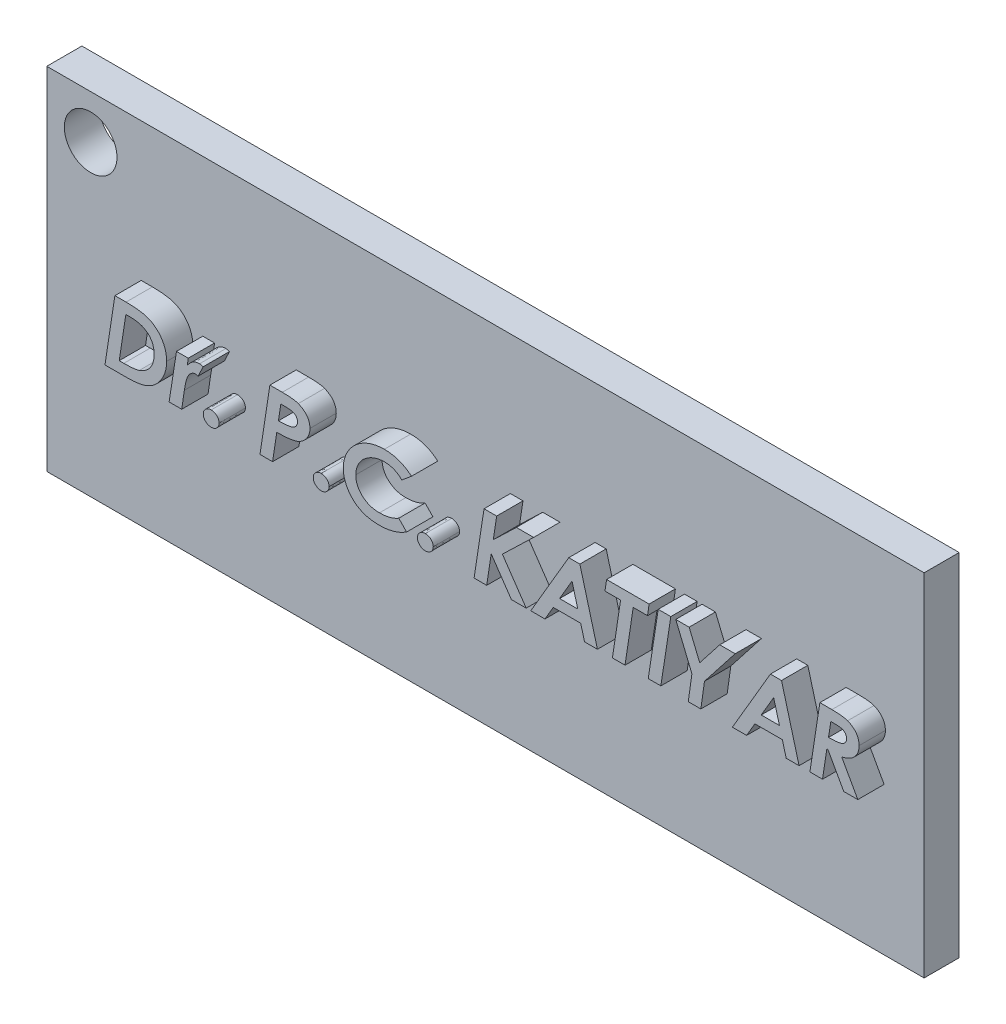
from build123d import *

# Parameters (mm, degrees)
SKETCH1_W           = 50
SKETCH1_H           = 20
BOSS_EXTRUDE1_DEPTH = 2
SKETCH2_R           = 1.5
CUT_EXTRUDE1_DEPTH  = 2
BOSS_EXTRUDE2_DEPTH = 1.5


with BuildPart() as part:
    # Sketch1 → Boss-Extrude1 (new body)
    with BuildSketch(Plane.XY):
        Rectangle(SKETCH1_W, SKETCH1_H)
    extrude(amount=BOSS_EXTRUDE1_DEPTH)

    # Sketch2 → Cut-Extrude1 (cut)
    with BuildSketch(Plane.XY.offset(2)):
        with Locations((-22.5, 7.5)):
            Circle(SKETCH2_R)
    extrude(amount=-CUT_EXTRUDE1_DEPTH, mode=Mode.SUBTRACT)

    # Sketch3 → Boss-Extrude2 (add)
    # profile 1 of 14: a face of its own
    with BuildSketch(Plane.XY.offset(2)):
        with BuildLine():
            Line((-19.618322876, 2.120230113), (-18.982411251, 2.120230113))
            add(Edge.make_bspline(
                [(-18.982411251, 2.120230113), (-18.910426999, 2.119678229), (-18.771099411, 2.118610042), (-18.569112915, 2.109927794), (-18.381253338, 2.09439893), (-18.207658036, 2.073252772), (-18.048344555, 2.046057077), (-17.903370359, 2.012808646), (-17.772236677, 1.974379293), (-17.654652897, 1.927094543), (-17.546335915, 1.87486867), (-17.444825411, 1.81494882), (-17.348670953, 1.748094557), (-17.256707082, 1.675274738), (-17.170399162, 1.594845432), (-17.089661137, 1.506798235), (-17.01296808, 1.412819612), (-16.94283675, 1.311942205), (-16.878923226, 1.20609193), (-16.822939281, 1.09537145), (-16.776662067, 0.980194019), (-16.737396953, 0.861662087), (-16.708059399, 0.738710988), (-16.686424434, 0.611834465), (-16.673714674, 0.480871104), (-16.67192349, 0.392338604), (-16.671017187, 0.34754298)],
                knots=[0, 0, 0, 0, 1.561455984, 3.022242913, 4.384337269, 5.649427236, 6.814641123, 7.888375834, 8.874559248, 9.775230347, 10.634285137, 11.480850549, 12.329182329, 13.172971857, 14.023337196, 14.885218906, 15.762543274, 16.652620804, 17.547922369, 18.442918428, 19.3406122, 20.238161656, 21.149081977, 22.07965206, 23.028343428, 24, 24, 24, 24], degree=3))
            add(Edge.make_bspline(
                [(-16.671017187, 0.34754298), (-16.671780039, 0.301249759), (-16.673297108, 0.209187337), (-16.68828465, 0.072934), (-16.710084764, -0.060827959), (-16.742080072, -0.19156929), (-16.783876693, -0.319401863), (-16.834445385, -0.444361532), (-16.893944227, -0.566352798), (-16.962104389, -0.68428977), (-17.03634567, -0.797292219), (-17.11682002, -0.903035602), (-17.201849591, -1.000685883), (-17.291476286, -1.090885771), (-17.386658319, -1.171855923), (-17.485165009, -1.247045108), (-17.589940958, -1.312173434), (-17.699736776, -1.370819865), (-17.817618417, -1.421653557), (-17.945153534, -1.465333196), (-18.083216306, -1.502377192), (-18.23257292, -1.531567283), (-18.39227004, -1.555155438), (-18.562852862, -1.572282758), (-18.744119171, -1.581533903), (-18.868624864, -1.583120227), (-18.932695873, -1.583936554)],
                knots=[0, 0, 0, 0, 0.989530604, 1.967860115, 2.927774675, 3.8859976, 4.842686724, 5.801245296, 6.76631842, 7.742458199, 8.712071235, 9.655629806, 10.581547416, 11.479101099, 12.371717121, 13.251788354, 14.126359635, 15.006494433, 15.911388636, 16.868106998, 17.886763428, 18.965488704, 20.120356611, 21.337604909, 22.629923347, 24, 24, 24, 24], degree=3))
            Line((-18.932695873, -1.583936554), (-20.185226589, -1.583936554))
            Line((-20.185226589, -1.583936554), (-19.618322876, 2.120230113))
        make_face()
        with BuildLine():
            Line((-18.99354156, 1.502869002), (-19.371972048, -0.966575443))
            Line((-19.371972048, -0.966575443), (-19.108554747, -0.966575443))
            add(Edge.make_bspline(
                [(-19.108554747, -0.966575443), (-19.059575707, -0.966347203), (-18.965306144, -0.965907912), (-18.829018501, -0.96098868), (-18.703235258, -0.955188788), (-18.588003809, -0.944273731), (-18.483186141, -0.932318027), (-18.388985647, -0.916370905), (-18.304575648, -0.899725075), (-18.252897111, -0.883637882), (-18.228518356, -0.876048934)],
                knots=[0, 0, 0, 0, 1.324035312, 2.548360026, 3.686691926, 4.727350479, 5.677003977, 6.537746933, 7.310198951, 8, 8, 8, 8], degree=3))
            add(Edge.make_bspline(
                [(-18.228518356, -0.876048934), (-18.197107799, -0.865018685), (-18.134978617, -0.843201168), (-18.047025369, -0.800448834), (-17.962261684, -0.755267825), (-17.883846554, -0.701759178), (-17.808762208, -0.644052153), (-17.73971443, -0.579068729), (-17.67344379, -0.510113206), (-17.613681352, -0.434358636), (-17.559802976, -0.353629196), (-17.511420053, -0.268849078), (-17.47246504, -0.178225012), (-17.439694551, -0.083533353), (-17.414708854, 0.015837991), (-17.395689908, 0.119365784), (-17.385675089, 0.227878504), (-17.384138927, 0.301767121), (-17.383356931, 0.339380754)],
                knots=[0, 0, 0, 0, 1.004385182, 1.986645124, 2.949287716, 3.902145798, 4.84933791, 5.805935225, 6.762182609, 7.734970088, 8.714756643, 9.691178478, 10.677773128, 11.688662836, 12.71393487, 13.76873202, 14.864153959, 16, 16, 16, 16], degree=3))
            add(Edge.make_bspline(
                [(-17.383356931, 0.339380754), (-17.383620267, 0.370321176), (-17.384135295, 0.43083394), (-17.392975134, 0.519481552), (-17.405310456, 0.604524994), (-17.42271073, 0.685751125), (-17.446386668, 0.762840588), (-17.473244502, 0.836721454), (-17.50696446, 0.906139401), (-17.544752373, 0.972164018), (-17.588420815, 1.033455941), (-17.634567989, 1.092529381), (-17.686587653, 1.146474464), (-17.741052324, 1.198209995), (-17.801187136, 1.244856642), (-17.864769769, 1.2886188), (-17.932635463, 1.328894767), (-18.005005108, 1.365359549), (-18.082440326, 1.398269409), (-18.165834212, 1.426292404), (-18.255295561, 1.450155901), (-18.351067449, 1.468891899), (-18.452714895, 1.484982059), (-18.56055718, 1.494581887), (-18.674375839, 1.501769714), (-18.75237199, 1.502495845), (-18.792453986, 1.502869002)],
                knots=[0, 0, 0, 0, 1.070720061, 2.094096467, 3.081106723, 4.045228741, 4.966330401, 5.871369772, 6.763803125, 7.634779015, 8.501873381, 9.367147586, 10.227321899, 11.093739442, 11.965725062, 12.858815522, 13.764948058, 14.695554029, 15.662561964, 16.675350316, 17.738854968, 18.865733783, 20.052607652, 21.300059551, 22.612508424, 24, 24, 24, 24], degree=3))
            Line((-18.792453986, 1.502869002), (-18.99354156, 1.502869002))
        make_face(mode=Mode.SUBTRACT)
    # profile 2 of 14: a face of its own
    with BuildSketch(Plane.XY.offset(2)):
        with BuildLine():
            Line((-16.109307619, 1.122954472), (-15.438521027, 1.122954472))
            Line((-15.438521027, 1.122954472), (-15.490462466, 0.743039942))
            add(Edge.make_bspline(
                [(-15.490462466, 0.743039942), (-15.466426493, 0.776980318), (-15.419803323, 0.8428153), (-15.340550016, 0.92952912), (-15.258799173, 1.004066249), (-15.172899846, 1.064809293), (-15.08316065, 1.112243863), (-14.989731617, 1.145702606), (-14.892590561, 1.166788129), (-14.826461488, 1.169214623), (-14.792963134, 1.170443788)],
                knots=[0, 0, 0, 0, 1.168703509, 2.266962977, 3.29644637, 4.274958863, 5.217781779, 6.141968507, 7.058795269, 8, 8, 8, 8], degree=3))
            add(Edge.make_bspline(
                [(-14.792963134, 1.170443788), (-14.776600343, 1.169846884), (-14.743149779, 1.168626629), (-14.692657307, 1.159222303), (-14.640926523, 1.144363813), (-14.607083072, 1.130233391), (-14.589649499, 1.122954472)],
                knots=[0, 0, 0, 0, 0.933473506, 1.908306102, 2.922518346, 4, 4, 4, 4], degree=3))
            Line((-14.589649499, 1.122954472), (-14.876069438, 0.51820771))
            add(Edge.make_bspline(
                [(-14.876069438, 0.51820771), (-14.889345928, 0.523633549), (-14.913421378, 0.533472709), (-14.947756516, 0.543903629), (-14.975939704, 0.551251258), (-14.9932792, 0.552532295), (-15.000728893, 0.553082677)],
                knots=[0, 0, 0, 0, 1.322507463, 2.398221262, 3.311816268, 4, 4, 4, 4], degree=3))
            add(Edge.make_bspline(
                [(-15.000728893, 0.553082677), (-15.018840337, 0.552351188), (-15.054621459, 0.550906053), (-15.107426682, 0.539841886), (-15.158980566, 0.522969644), (-15.209044332, 0.498040764), (-15.257286398, 0.466013415), (-15.303522501, 0.426638666), (-15.348994785, 0.381254143), (-15.393531773, 0.327941502), (-15.435862455, 0.263523135), (-15.474533199, 0.185463362), (-15.512489709, 0.094164353), (-15.546868106, -0.011954407), (-15.579233646, -0.132123776), (-15.609380461, -0.266596294), (-15.637578312, -0.415085269), (-15.653544516, -0.519081441), (-15.661869217, -0.573304543)],
                knots=[0, 0, 0, 0, 0.613121191, 1.211287369, 1.820733016, 2.446548635, 3.099595783, 3.777645406, 4.500501715, 5.274033045, 6.12695242, 7.105034718, 8.220770885, 9.474111908, 10.88073466, 12.435809606, 14.141648357, 16, 16, 16, 16], degree=3))
            Line((-15.661869217, -0.573304543), (-15.80953131, -1.583936554))
            Line((-15.80953131, -1.583936554), (-16.528549239, -1.583936554))
            Line((-16.528549239, -1.583936554), (-16.109307619, 1.122954472))
        make_face()
    # profile 3 of 14: a face of its own
    with BuildSketch(Plane.XY.offset(2)):
        with BuildLine():
            add(Edge.make_bspline(
                [(-14.130338769, -0.776618178), (-14.100218265, -0.777790715), (-14.041438959, -0.780078888), (-13.957302781, -0.805580906), (-13.879173459, -0.84424955), (-13.810796736, -0.899252749), (-13.752254506, -0.963767818), (-13.71030736, -1.037788497), (-13.683267066, -1.118584611), (-13.680569723, -1.175112753), (-13.679190264, -1.204022024)],
                knots=[0, 0, 0, 0, 1.04412619, 2.037582574, 3.029847139, 4.058667806, 5.069942644, 6.040618506, 6.99794531, 8, 8, 8, 8], degree=3))
            add(Edge.make_bspline(
                [(-13.679190264, -1.204022024), (-13.680618826, -1.232426866), (-13.683435909, -1.288440398), (-13.710269235, -1.368807319), (-13.752493814, -1.442813196), (-13.810483506, -1.508130799), (-13.879434127, -1.562780442), (-13.956943781, -1.602913392), (-14.04164329, -1.626745277), (-14.100257695, -1.629838447), (-14.130338769, -1.63142587)],
                knots=[0, 0, 0, 0, 0.985964618, 1.944293933, 2.915986286, 3.934778525, 4.964676572, 5.961889648, 6.954036158, 8, 8, 8, 8], degree=3))
            add(Edge.make_bspline(
                [(-14.130338769, -1.63142587), (-14.160660884, -1.629828312), (-14.219749615, -1.626715149), (-14.30503139, -1.60308631), (-14.382675674, -1.562726824), (-14.451735339, -1.508386356), (-14.508796859, -1.442526045), (-14.551398598, -1.368983215), (-14.577005298, -1.288283974), (-14.579977855, -1.232399356), (-14.581487273, -1.204022024)],
                knots=[0, 0, 0, 0, 1.053402516, 2.05276639, 3.048906082, 4.077695563, 5.08974386, 6.060390299, 7.015096659, 8, 8, 8, 8], degree=3))
            add(Edge.make_bspline(
                [(-14.581487273, -1.204022024), (-14.580024913, -1.175140989), (-14.577169248, -1.11874275), (-14.551359933, -1.037612396), (-14.509037884, -0.964056729), (-14.451421092, -0.898994615), (-14.382936144, -0.844304414), (-14.304672973, -0.805408068), (-14.219953029, -0.780107489), (-14.160700251, -0.777800363), (-14.130338769, -0.776618178)],
                knots=[0, 0, 0, 0, 1.000983421, 1.95469804, 2.924336179, 3.928852235, 4.956573018, 5.94777678, 6.948428378, 8, 8, 8, 8], degree=3))
        make_face()
    # profile 4 of 14: a face of its own
    with BuildSketch(Plane.XY.offset(2)):
        with BuildLine():
            Line((-10.785310056, 2.120230113), (-10.078164456, 2.120230113))
            add(Edge.make_bspline(
                [(-10.078164456, 2.120230113), (-10.026464721, 2.12004241), (-9.92699392, 2.119681269), (-9.783746865, 2.114248321), (-9.652340696, 2.106360233), (-9.53280964, 2.095302986), (-9.424745971, 2.081690445), (-9.328715296, 2.063848475), (-9.244011067, 2.044074388), (-9.193046543, 2.025693589), (-9.169189263, 2.017089254)],
                knots=[0, 0, 0, 0, 1.350094369, 2.597594869, 3.743129653, 4.78761075, 5.732242932, 6.586166449, 7.338162699, 8, 8, 8, 8], degree=3))
            add(Edge.make_bspline(
                [(-9.169189263, 2.017089254), (-9.142579514, 2.006290886), (-9.090134587, 1.985008476), (-9.015509758, 1.948035356), (-8.945986818, 1.907318459), (-8.880723499, 1.865018976), (-8.821117765, 1.818360878), (-8.765735751, 1.769616761), (-8.716128738, 1.716716469), (-8.671281203, 1.661003953), (-8.632223646, 1.602042363), (-8.596888427, 1.541482084), (-8.568078357, 1.477936796), (-8.544046023, 1.412253473), (-8.525587797, 1.343714474), (-8.512147096, 1.272793742), (-8.504881332, 1.199285223), (-8.503538273, 1.149681654), (-8.502854794, 1.124438513)],
                knots=[0, 0, 0, 0, 1.156331478, 2.279003848, 3.350293464, 4.400203319, 5.408454783, 6.396222918, 7.368702579, 8.325493981, 9.273166673, 10.214693597, 11.146313618, 12.079104618, 13.028817061, 14.001806809, 14.983124143, 16, 16, 16, 16], degree=3))
            add(Edge.make_bspline(
                [(-8.502854794, 1.124438513), (-8.503375027, 1.09671012), (-8.50440943, 1.041576432), (-8.514213676, 0.960120957), (-8.530805653, 0.880809432), (-8.553232388, 0.80346988), (-8.581015948, 0.727354883), (-8.617183059, 0.654048919), (-8.658720828, 0.582545046), (-8.706363045, 0.513806814), (-8.758418339, 0.447655136), (-8.816792906, 0.387131161), (-8.878463537, 0.330264986), (-8.944760702, 0.278249609), (-9.015461975, 0.230686278), (-9.090282199, 0.187646305), (-9.169705803, 0.14963051), (-9.254771046, 0.115506351), (-9.349638552, 0.08644653), (-9.456884616, 0.060508132), (-9.578349091, 0.038800244), (-9.714010092, 0.020334861), (-9.863770107, 0.005740808), (-10.02785488, -0.004934515), (-10.205963533, -0.013398488), (-10.329452037, -0.015630865), (-10.393523197, -0.016789118)],
                knots=[0, 0, 0, 0, 0.800821521, 1.592311643, 2.365890732, 3.1393378, 3.917129741, 4.703312133, 5.497474965, 6.304172697, 7.117708976, 7.926398049, 8.730559986, 9.539659362, 10.358170105, 11.190414377, 12.030961153, 12.900089116, 13.835758299, 14.894687615, 16.086017585, 17.398735374, 18.849211568, 20.432030526, 22.148783621, 24, 24, 24, 24], degree=3))
            Line((-10.393523197, -0.016789118), (-10.63319584, -1.583936554))
            Line((-10.63319584, -1.583936554), (-11.352213769, -1.583936554))
            Line((-11.352213769, -1.583936554), (-10.785310056, 2.120230113))
        make_face()
        with BuildLine():
            add(Edge.make_bspline(
                [(-10.299286585, 0.600571993), (-10.245610368, 0.60135193), (-10.143173172, 0.602840383), (-9.996631261, 0.608245084), (-9.864715042, 0.618608888), (-9.747299968, 0.632317308), (-9.644683707, 0.649849575), (-9.556324323, 0.670738818), (-9.482750965, 0.696440562), (-9.421753633, 0.725535043), (-9.372856036, 0.760190251), (-9.330281106, 0.796759004), (-9.294559714, 0.837729121), (-9.265207766, 0.882640838), (-9.242961459, 0.931545478), (-9.226353705, 0.984033756), (-9.216690655, 1.040480048), (-9.21569954, 1.079386058), (-9.215194538, 1.099209813)],
                knots=[0, 0, 0, 0, 1.921982762, 3.667965772, 5.249123301, 6.658381958, 7.898792606, 8.974843245, 9.904719115, 10.684913469, 11.385006885, 12.043958073, 12.690413885, 13.324127988, 13.958089539, 14.607872785, 15.290670272, 16, 16, 16, 16], degree=3))
            add(Edge.make_bspline(
                [(-9.215194538, 1.099209813), (-9.216230619, 1.121296741), (-9.218257528, 1.164505916), (-9.232935159, 1.226622993), (-9.259101784, 1.283034681), (-9.294782179, 1.333864501), (-9.340968066, 1.377860384), (-9.396207143, 1.415991947), (-9.462102074, 1.44488705), (-9.52439525, 1.463443127), (-9.582484935, 1.475011899), (-9.636817406, 1.481905205), (-9.700367755, 1.488759496), (-9.773901521, 1.493581686), (-9.856998968, 1.498162134), (-9.950024513, 1.501007567), (-10.052437347, 1.502281814), (-10.123922085, 1.502667495), (-10.16127076, 1.502869002)],
                knots=[0, 0, 0, 0, 0.915307377, 1.790637304, 2.625586519, 3.478965106, 4.349055473, 5.256230212, 6.247299954, 7.317712155, 7.945056117, 8.700492196, 9.58703864, 10.594362115, 11.754548043, 13.036790225, 14.451809948, 16, 16, 16, 16], degree=3))
            Line((-10.16127076, 1.502869002), (-10.299286585, 0.600571993))
        make_face(mode=Mode.SUBTRACT)
    # profile 5 of 14: a face of its own
    with BuildSketch(Plane.XY.offset(2)):
        with BuildLine():
            add(Edge.make_bspline(
                [(-7.861749025, -0.776618178), (-7.831628522, -0.777790715), (-7.772849215, -0.780078888), (-7.688713037, -0.805580906), (-7.610583715, -0.84424955), (-7.542206992, -0.899252749), (-7.483664763, -0.963767818), (-7.441717617, -1.037788497), (-7.414677322, -1.118584611), (-7.411979979, -1.175112753), (-7.410600521, -1.204022024)],
                knots=[0, 0, 0, 0, 1.04412619, 2.037582574, 3.029847139, 4.058667806, 5.069942644, 6.040618506, 6.99794531, 8, 8, 8, 8], degree=3))
            add(Edge.make_bspline(
                [(-7.410600521, -1.204022024), (-7.412029083, -1.232426866), (-7.414846166, -1.288440398), (-7.441679491, -1.368807319), (-7.48390407, -1.442813196), (-7.541893762, -1.508130799), (-7.610844383, -1.562780442), (-7.688354038, -1.602913392), (-7.773053546, -1.626745277), (-7.831667951, -1.629838447), (-7.861749025, -1.63142587)],
                knots=[0, 0, 0, 0, 0.985964618, 1.944293933, 2.915986286, 3.934778525, 4.964676572, 5.961889648, 6.954036158, 8, 8, 8, 8], degree=3))
            add(Edge.make_bspline(
                [(-7.861749025, -1.63142587), (-7.89207114, -1.629828312), (-7.951159872, -1.626715149), (-8.036441646, -1.60308631), (-8.11408593, -1.562726824), (-8.183145596, -1.508386356), (-8.240207116, -1.442526045), (-8.282808854, -1.368983215), (-8.308415555, -1.288283974), (-8.311388111, -1.232399356), (-8.312897529, -1.204022024)],
                knots=[0, 0, 0, 0, 1.053402516, 2.05276639, 3.048906082, 4.077695563, 5.08974386, 6.060390299, 7.015096659, 8, 8, 8, 8], degree=3))
            add(Edge.make_bspline(
                [(-8.312897529, -1.204022024), (-8.311435169, -1.175140989), (-8.308579505, -1.11874275), (-8.282770189, -1.037612396), (-8.24044814, -0.964056729), (-8.182831348, -0.898994615), (-8.114346401, -0.844304414), (-8.036083229, -0.805408068), (-7.951363285, -0.780107489), (-7.892110508, -0.777800363), (-7.861749025, -0.776618178)],
                knots=[0, 0, 0, 0, 1.000983421, 1.95469804, 2.924336179, 3.928852235, 4.956573018, 5.94777678, 6.948428378, 8, 8, 8, 8], degree=3))
        make_face()
    # profile 6 of 14: a face of its own
    with BuildSketch(Plane.XY.offset(2)):
        with BuildLine():
            Line((-2.717320439, 1.654241197), (-3.26864172, 1.194930467))
            add(Edge.make_bspline(
                [(-3.26864172, 1.194930467), (-3.2993592, 1.226117137), (-3.360797108, 1.288493471), (-3.466070896, 1.368773466), (-3.580849227, 1.43801238), (-3.704856416, 1.495570719), (-3.836205181, 1.541825659), (-3.974015277, 1.574237463), (-4.11743409, 1.593991843), (-4.214901651, 1.596548418), (-4.26443332, 1.597847634)],
                knots=[0, 0, 0, 0, 0.949579327, 1.899249786, 2.865497464, 3.855457373, 4.862749324, 5.884090577, 6.924724051, 8, 8, 8, 8], degree=3))
            add(Edge.make_bspline(
                [(-4.26443332, 1.597847634), (-4.299577211, 1.597332652), (-4.369505269, 1.596307959), (-4.473621713, 1.586356662), (-4.576394417, 1.56986851), (-4.678171561, 1.547441797), (-4.779362139, 1.519753493), (-4.878851229, 1.483429301), (-4.977519396, 1.442052126), (-5.074550868, 1.394777027), (-5.167854237, 1.341794767), (-5.25645959, 1.284433406), (-5.339970558, 1.223566921), (-5.418101667, 1.158158597), (-5.490689415, 1.088233765), (-5.558721331, 1.01488953), (-5.620127917, 0.936565632), (-5.676567108, 0.855155032), (-5.72689175, 0.770852406), (-5.770531342, 0.684737793), (-5.808435411, 0.597564426), (-5.837445603, 0.508355194), (-5.861779326, 0.418088859), (-5.878815288, 0.326311709), (-5.888446146, 0.232982981), (-5.890107196, 0.170468536), (-5.890942401, 0.139035201)],
                knots=[0, 0, 0, 0, 1.046357943, 2.082005643, 3.111321297, 4.144346303, 5.184463487, 6.232893428, 7.295841869, 8.369758779, 9.445089336, 10.489111365, 11.511551793, 12.520665863, 13.5208965, 14.511370151, 15.497231816, 16.482047298, 17.45978564, 18.418386774, 19.355581219, 20.287288921, 21.209191212, 22.138128789, 23.063819192, 24, 24, 24, 24], degree=3))
            add(Edge.make_bspline(
                [(-5.890942401, 0.139035201), (-5.889847084, 0.096920788), (-5.8876914, 0.01403584), (-5.869298273, -0.107555692), (-5.839944291, -0.223849376), (-5.797749342, -0.334312743), (-5.745078778, -0.439991506), (-5.679208274, -0.539348077), (-5.602172645, -0.633839053), (-5.513479997, -0.721141036), (-5.415924828, -0.801338197), (-5.310432122, -0.871105357), (-5.198234568, -0.930015911), (-5.079625819, -0.978748694), (-4.953886585, -1.015393175), (-4.82160971, -1.042117424), (-4.682869684, -1.058885553), (-4.588002326, -1.060654058), (-4.53972295, -1.061554075)],
                knots=[0, 0, 0, 0, 0.998688869, 1.965509397, 2.910554289, 3.839131674, 4.765518533, 5.706253965, 6.661248593, 7.652965335, 8.653789702, 9.653099025, 10.647935907, 11.655925641, 12.69013546, 13.750063058, 14.85497441, 16, 16, 16, 16], degree=3))
            add(Edge.make_bspline(
                [(-4.53972295, -1.061554075), (-4.487752822, -1.060721673), (-4.385368371, -1.059081787), (-4.234671355, -1.045456045), (-4.089187306, -1.023206754), (-3.949030168, -0.992292684), (-3.813940184, -0.951926995), (-3.68415831, -0.903101144), (-3.559398313, -0.845389298), (-3.480768245, -0.799511038), (-3.441532512, -0.776618178)],
                knots=[0, 0, 0, 0, 1.085296555, 2.138103133, 3.157319172, 4.157505, 5.133271947, 6.099474207, 7.051653842, 8, 8, 8, 8], degree=3))
            Line((-3.441532512, -0.776618178), (-2.99409411, -1.235186888))
            add(Edge.make_bspline(
                [(-2.99409411, -1.235186888), (-3.051216903, -1.270691838), (-3.165291765, -1.341595626), (-3.345608913, -1.432255731), (-3.533068862, -1.507599249), (-3.726685246, -1.570214363), (-3.926757642, -1.619387877), (-4.133606183, -1.653968045), (-4.347085047, -1.675370537), (-4.491688346, -1.677723206), (-4.564951649, -1.678915187)],
                knots=[0, 0, 0, 0, 0.974566438, 1.946220217, 2.920911948, 3.900523539, 4.893564957, 5.904413292, 6.9382704, 8, 8, 8, 8], degree=3))
            add(Edge.make_bspline(
                [(-4.564951649, -1.678915187), (-4.616169317, -1.67817232), (-4.71697928, -1.676710162), (-4.865063387, -1.666109111), (-5.00755044, -1.649352293), (-5.143800379, -1.624907709), (-5.274327728, -1.593567886), (-5.399221655, -1.556109644), (-5.518084848, -1.510608974), (-5.631217821, -1.458723352), (-5.738481725, -1.399785815), (-5.840457532, -1.334430155), (-5.93686268, -1.262175257), (-6.028592559, -1.184391243), (-6.114093972, -1.099259636), (-6.194401816, -1.007778048), (-6.269304475, -0.909876871), (-6.338018652, -0.806150009), (-6.400389325, -0.698288801), (-6.45422797, -0.587019225), (-6.500881923, -0.474012211), (-6.5377031, -0.358178738), (-6.567696793, -0.240604608), (-6.5885681, -0.120300687), (-6.600331024, 0.002019096), (-6.602295814, 0.084348958), (-6.603282145, 0.125678831)],
                knots=[0, 0, 0, 0, 1.207814714, 2.377299922, 3.499480781, 4.589905874, 5.639695034, 6.663824488, 7.662657076, 8.638799862, 9.596876257, 10.546677536, 11.492817713, 12.436166671, 13.380723168, 14.335526633, 15.305041465, 16.285444966, 17.267980555, 18.241068549, 19.198629845, 20.148646044, 21.105016221, 22.058250398, 23.025235049, 24, 24, 24, 24], degree=3))
            add(Edge.make_bspline(
                [(-6.603282145, 0.125678831), (-6.602241697, 0.170241843), (-6.600166671, 0.259116528), (-6.584675245, 0.391784569), (-6.560410404, 0.523003655), (-6.526035937, 0.653013699), (-6.481479716, 0.78118415), (-6.426785249, 0.907945168), (-6.362926749, 1.033400715), (-6.289691162, 1.156913855), (-6.208025359, 1.276241541), (-6.118440544, 1.389713776), (-6.021723547, 1.496497487), (-5.918842699, 1.597617088), (-5.808454826, 1.691543579), (-5.690779318, 1.778156803), (-5.566752543, 1.859518564), (-5.435644478, 1.933149268), (-5.300107642, 1.999850184), (-5.160365616, 2.057077821), (-5.017985998, 2.106148019), (-4.872583158, 2.146413655), (-4.723980599, 2.176615249), (-4.572666963, 2.198952184), (-4.41803853, 2.212683938), (-4.313929062, 2.214362745), (-4.261465238, 2.215208745)],
                knots=[0, 0, 0, 0, 0.922395876, 1.839589333, 2.7615445, 3.683129879, 4.620750163, 5.568107449, 6.539083278, 7.533182566, 8.538755005, 9.530398321, 10.52378521, 11.519557945, 12.514843431, 13.521562505, 14.542724138, 15.58370835, 16.632559194, 17.668101221, 18.707711794, 19.748733786, 20.789125917, 21.844953231, 22.914008517, 24, 24, 24, 24], degree=3))
            add(Edge.make_bspline(
                [(-4.261465238, 2.215208745), (-4.188173657, 2.213497771), (-4.043842379, 2.210128393), (-3.831046755, 2.183427966), (-3.62579683, 2.140084921), (-3.428247231, 2.07792174), (-3.23802899, 1.999164939), (-3.055720803, 1.902231877), (-2.880861681, 1.787584148), (-2.772227213, 1.6990093), (-2.717320439, 1.654241197)],
                knots=[0, 0, 0, 0, 1.04715348, 2.062133196, 3.059773547, 4.04136021, 5.017502843, 5.997885874, 6.98807783, 8, 8, 8, 8], degree=3))
        make_face()
    # profile 7 of 14: a face of its own
    with BuildSketch(Plane.XY.offset(2)):
        with BuildLine():
            add(Edge.make_bspline(
                [(-1.925584495, -0.776618178), (-1.895463992, -0.777790715), (-1.836684685, -0.780078888), (-1.752548507, -0.805580906), (-1.674419185, -0.84424955), (-1.606042462, -0.899252749), (-1.547500233, -0.963767818), (-1.505553087, -1.037788497), (-1.478512793, -1.118584611), (-1.475815449, -1.175112753), (-1.474435991, -1.204022024)],
                knots=[0, 0, 0, 0, 1.04412619, 2.037582574, 3.029847139, 4.058667806, 5.069942644, 6.040618506, 6.99794531, 8, 8, 8, 8], degree=3))
            add(Edge.make_bspline(
                [(-1.474435991, -1.204022024), (-1.475864553, -1.232426866), (-1.478681636, -1.288440398), (-1.505514961, -1.368807319), (-1.54773954, -1.442813196), (-1.605729232, -1.508130799), (-1.674679854, -1.562780442), (-1.752189508, -1.602913392), (-1.836889016, -1.626745277), (-1.895503421, -1.629838447), (-1.925584495, -1.63142587)],
                knots=[0, 0, 0, 0, 0.985964618, 1.944293933, 2.915986286, 3.934778525, 4.964676572, 5.961889648, 6.954036158, 8, 8, 8, 8], degree=3))
            add(Edge.make_bspline(
                [(-1.925584495, -1.63142587), (-1.95590661, -1.629828312), (-2.014995342, -1.626715149), (-2.100277116, -1.60308631), (-2.1779214, -1.562726824), (-2.246981066, -1.508386356), (-2.304042586, -1.442526045), (-2.346644325, -1.368983215), (-2.372251025, -1.288283974), (-2.375223582, -1.232399356), (-2.376732999, -1.204022024)],
                knots=[0, 0, 0, 0, 1.053402516, 2.05276639, 3.048906082, 4.077695563, 5.08974386, 6.060390299, 7.015096659, 8, 8, 8, 8], degree=3))
            add(Edge.make_bspline(
                [(-2.376732999, -1.204022024), (-2.375270639, -1.175140989), (-2.372414975, -1.11874275), (-2.346605659, -1.037612396), (-2.30428361, -0.964056729), (-2.246666818, -0.898994615), (-2.178181871, -0.844304414), (-2.099918699, -0.805408068), (-2.015198755, -0.780107489), (-1.955945978, -0.777800363), (-1.925584495, -0.776618178)],
                knots=[0, 0, 0, 0, 1.000983421, 1.95469804, 2.924336179, 3.928852235, 4.956573018, 5.94777678, 6.948428378, 8, 8, 8, 8], degree=3))
        make_face()
    # profile 8 of 14: a face of its own
    with BuildSketch(Plane.XY.offset(2)):
        Polygon((1.419444218, 2.120230113), (2.138462146, 2.120230113), (1.944052758, 0.850632924), (3.262623304, 2.120230113), (4.248026616, 2.120230113), (2.464951195, 0.402452502), (3.82136479, -1.583936554), (2.978429427, -1.583936554), (1.82903957, 0.09896609), (1.571558434, -1.583936554), (0.852540505, -1.583936554), align=None)
    # profile 9 of 14: a face of its own
    with BuildSketch(Plane.XY.offset(2)):
        Polygon((6.247772042, 2.120230113), (6.879973565, 2.120230113), (7.880959308, -1.583936554), (7.147100968, -1.583936554), (6.928946922, -0.776618178), (5.363283527, -0.776618178), (4.891358447, -1.583936554), (4.081814009, -1.583936554), align=None)
        Polygon((6.761992294, -0.159257067), (6.434019204, 1.05468858), (5.724647543, -0.159257067), align=None, mode=Mode.SUBTRACT)
    # profile 10 of 14: a face of its own
    with BuildSketch(Plane.XY.offset(2)):
        Polygon((8.403341787, 2.120230113), (10.825296915, 2.120230113), (10.738480509, 1.502869002), (9.920773845, 1.502869002), (9.454784929, -1.583936554), (8.735767001, -1.583936554), (9.201755916, 1.502869002), (8.311331237, 1.502869002), align=None)
    # profile 11 of 14: a face of its own
    with BuildSketch(Plane.XY.offset(2)):
        Polygon((11.344711312, 2.120230113), (12.06372924, 2.120230113), (11.496825528, -1.583936554), (10.777807599, -1.583936554), align=None)
    # profile 12 of 14: a face of its own
    with BuildSketch(Plane.XY.offset(2)):
        Polygon((12.344955035, 2.120230113), (13.107752177, 2.120230113), (13.711014897, 0.665127782), (14.851500508, 2.120230113), (15.731536899, 2.120230113), (13.984078466, -0.109541689), (13.775570687, -1.583936554), (13.057294778, -1.583936554), (13.266544578, -0.103605524), align=None)
    # profile 13 of 14: a face of its own
    with BuildSketch(Plane.XY.offset(2)):
        Polygon((17.740186572, 2.120230113), (18.372388094, 2.120230113), (19.373373838, -1.583936554), (18.639515498, -1.583936554), (18.421361452, -0.776618178), (16.855698057, -0.776618178), (16.383772977, -1.583936554), (15.574228539, -1.583936554), align=None)
        Polygon((18.254406824, -0.159257067), (17.926433734, 1.05468858), (17.217062073, -0.159257067), align=None, mode=Mode.SUBTRACT)
    # profile 14 of 14: a face of its own
    with BuildSketch(Plane.XY.offset(2)):
        with BuildLine():
            Line((20.557638662, 2.120230113), (21.244749706, 2.120230113))
            add(Edge.make_bspline(
                [(21.244749706, 2.120230113), (21.295706988, 2.120035413), (21.393940562, 2.119660079), (21.535216138, 2.114307299), (21.664873631, 2.106245103), (21.782756897, 2.095584498), (21.888983586, 2.080845476), (21.983532691, 2.062957484), (22.066845582, 2.043480784), (22.117012673, 2.024966682), (22.14036853, 2.016347233)],
                knots=[0, 0, 0, 0, 1.349946929, 2.60237803, 3.744846885, 4.791373278, 5.737548612, 6.584487838, 7.34099231, 8, 8, 8, 8], degree=3))
            add(Edge.make_bspline(
                [(22.14036853, 2.016347233), (22.166699776, 2.005224013), (22.218202793, 1.983467374), (22.292102693, 1.947143245), (22.360689838, 1.907147979), (22.423531683, 1.862889492), (22.482803309, 1.817235791), (22.536184789, 1.767315155), (22.584590633, 1.714301559), (22.628617472, 1.658743427), (22.667067858, 1.600000491), (22.700889466, 1.538860927), (22.728881288, 1.474603956), (22.752931128, 1.408112383), (22.770698676, 1.33848354), (22.782879475, 1.266484202), (22.791809459, 1.191936112), (22.792336604, 1.141285359), (22.792604608, 1.115534266)],
                knots=[0, 0, 0, 0, 1.153023725, 2.255274955, 3.319751785, 4.35222478, 5.354306253, 6.335705399, 7.296236054, 8.248437649, 9.192183932, 10.125533412, 11.063724308, 12.016866556, 12.975269787, 13.957936334, 14.961804758, 16, 16, 16, 16], degree=3))
            add(Edge.make_bspline(
                [(22.792604608, 1.115534266), (22.791975626, 1.083834798), (22.790732735, 1.021195482), (22.77834711, 0.92910606), (22.759194206, 0.840447459), (22.732417107, 0.755115031), (22.697377814, 0.673469838), (22.654920991, 0.595214635), (22.604774466, 0.520410289), (22.546881605, 0.449422559), (22.481732602, 0.382064587), (22.40730244, 0.321531963), (22.326520831, 0.26447025), (22.236519826, 0.21444876), (22.139613853, 0.168143992), (22.034076292, 0.128590304), (21.921618963, 0.092393688), (21.842972362, 0.074159088), (21.802749172, 0.064833144)],
                knots=[0, 0, 0, 0, 0.964476537, 1.905841181, 2.822955888, 3.723069052, 4.623717389, 5.523263553, 6.429559037, 7.360873452, 8.308599956, 9.276479573, 10.276961086, 11.315449195, 12.406668279, 13.543482399, 14.743633285, 16, 16, 16, 16], degree=3))
            Line((21.802749172, 0.064833144), (22.721370633, -1.583936554))
            Line((22.721370633, -1.583936554), (21.919988422, -1.583936554))
            Line((21.919988422, -1.583936554), (21.020659495, 0.030700198))
            Line((21.020659495, 0.030700198), (20.956845727, 0.030700198))
            Line((20.956845727, 0.030700198), (20.709752878, -1.583936554))
            Line((20.709752878, -1.583936554), (19.990734949, -1.583936554))
            Line((19.990734949, -1.583936554), (20.557638662, 2.120230113))
        make_face()
        with BuildLine():
            add(Edge.make_bspline(
                [(21.051082339, 0.648061309), (21.102288371, 0.648501046), (21.200037565, 0.649340478), (21.339608439, 0.655261909), (21.465132029, 0.664532367), (21.576518612, 0.677862465), (21.674234891, 0.693742863), (21.758031936, 0.713152134), (21.828087351, 0.736621001), (21.88535485, 0.764241386), (21.931843234, 0.796678885), (21.971706442, 0.831596398), (22.005070728, 0.870496628), (22.03354019, 0.912399793), (22.053618436, 0.959002608), (22.069985487, 1.008478936), (22.078547483, 1.062060954), (22.079684493, 1.098937304), (22.080264864, 1.117760328)],
                knots=[0, 0, 0, 0, 1.932594909, 3.689205832, 5.271519917, 6.681849969, 7.921890019, 9.006465027, 9.924597768, 10.705304088, 11.396678332, 12.057965673, 12.699927993, 13.326501861, 13.961571801, 14.608133151, 15.289540776, 16, 16, 16, 16], degree=3))
            add(Edge.make_bspline(
                [(22.080264864, 1.117760328), (22.079198887, 1.13910561), (22.077129095, 1.180551412), (22.062996951, 1.240357424), (22.038201815, 1.29451116), (22.003395848, 1.342635124), (21.959818394, 1.38437585), (21.907720344, 1.420192321), (21.845897289, 1.446627981), (21.78824405, 1.465341108), (21.733905263, 1.475453178), (21.682920707, 1.482856192), (21.622541575, 1.489422433), (21.552501957, 1.49453024), (21.473309364, 1.497869272), (21.384520749, 1.501117246), (21.286305205, 1.502249393), (21.217542084, 1.502656612), (21.181677958, 1.502869002)],
                knots=[0, 0, 0, 0, 0.930416126, 1.806574545, 2.66062302, 3.510508876, 4.379872684, 5.280118822, 6.250181171, 7.300637457, 7.916032165, 8.65717143, 9.546698037, 10.563118954, 11.718172987, 13.002090278, 14.436408834, 16, 16, 16, 16], degree=3))
            Line((21.181677958, 1.502869002), (21.051082339, 0.648061309))
        make_face(mode=Mode.SUBTRACT)
    extrude(amount=BOSS_EXTRUDE2_DEPTH)


solid = part.part
